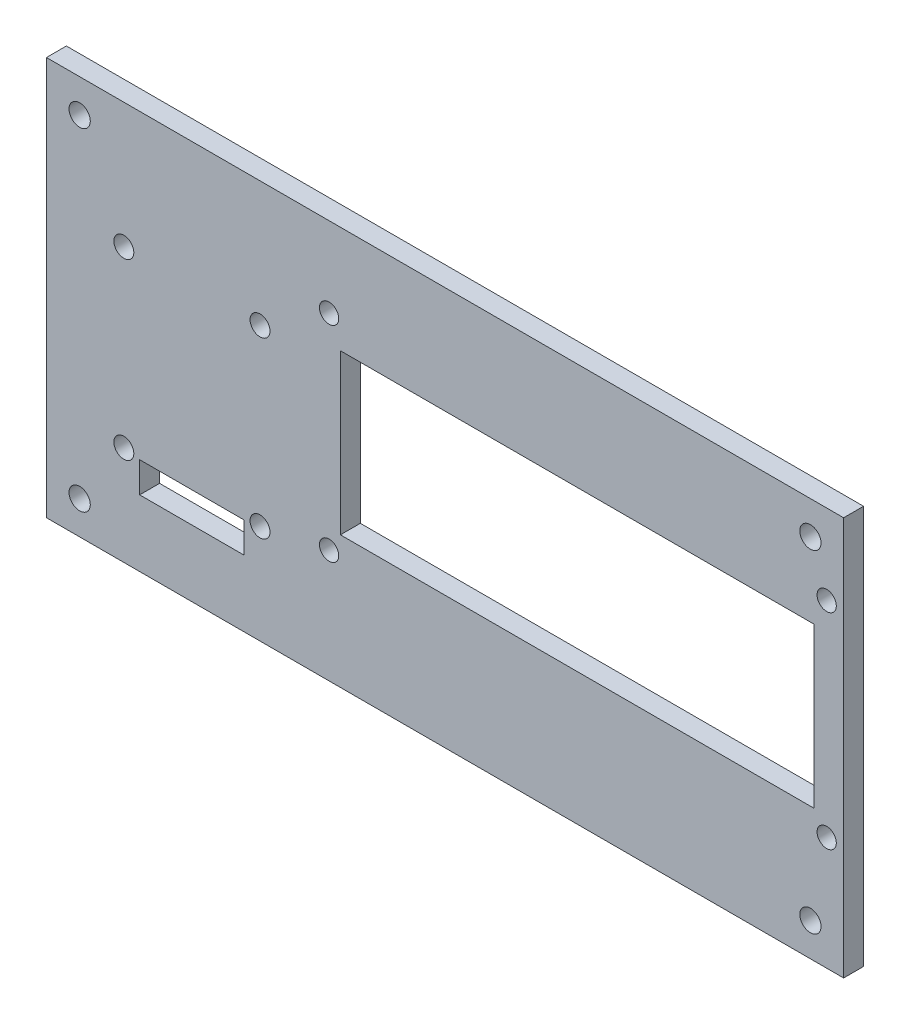
from build123d import *

# Parameters (mm, degrees)
SKETCH1_W           = 120
SKETCH1_H           = 60
BOSS_EXTRUDE1_DEPTH = 3
SKETCH3_R           = 1.6
CUT_EXTRUDE2_DEPTH  = 73.520148402
SKETCH5_R           = 1.45
CUT_EXTRUDE4_DEPTH  = 73.520148402
SKETCH7_W           = 71.3
SKETCH7_H           = 24
CUT_EXTRUDE5_DEPTH  = 73.520148402
SKETCH8_R           = 1.5
SKETCH8_W           = 15.689778119
SKETCH8_H           = 4.586192705
CUT_EXTRUDE6_DEPTH  = 73.520148402


with BuildPart() as part:
    # Sketch1 → Boss-Extrude1 (new body)
    with BuildSketch(Plane.XY):
        with Locations((3.092575742, -5.63002681)):
            Rectangle(SKETCH1_W, SKETCH1_H)
    extrude(amount=BOSS_EXTRUDE1_DEPTH)

    # Sketch3 → Cut-Extrude2 (cut, through all)
    with BuildSketch(Plane.XY.offset(3)):
        with Locations((58.092575742, 19.36997319)):
            Circle(SKETCH3_R)
        with Locations((58.092575742, -30.63002681)):
            Circle(SKETCH3_R)
        with Locations((-51.907424258, -30.63002681)):
            Circle(SKETCH3_R)
        with Locations((-51.907424258, 19.36997319)):
            Circle(SKETCH3_R)
    extrude(amount=-CUT_EXTRUDE2_DEPTH, mode=Mode.SUBTRACT)

    # Sketch5 → Cut-Extrude4 (cut, through all)
    with BuildSketch(Plane(origin=(0, 0, 0), x_dir=(-1, 0, 0), z_dir=(0, 0, -1))):
        with Locations((14.357424258, 12.31997319)):
            Circle(SKETCH5_R)
        with Locations((14.357424258, -18.58002681)):
            Circle(SKETCH5_R)
        with Locations((-60.542575742, -18.58002681)):
            Circle(SKETCH5_R)
        with Locations((-60.542575742, 12.31997319)):
            Circle(SKETCH5_R)
    extrude(amount=-CUT_EXTRUDE4_DEPTH, mode=Mode.SUBTRACT)

    # Sketch7 → Cut-Extrude5 (cut, through all)
    with BuildSketch(Plane.XY.offset(3)):
        with Locations((22.992575742, -3.73002681)):
            Rectangle(SKETCH7_W, SKETCH7_H)
    extrude(amount=-CUT_EXTRUDE5_DEPTH, mode=Mode.SUBTRACT)

    # Sketch8 → Cut-Extrude6 (cut, through all)
    with BuildSketch(Plane.XY.offset(3)):
        with Locations((-45.257424258, 5.51997319)):
            Circle(SKETCH8_R)
        with Locations((-24.757424258, 5.51997319)):
            Circle(SKETCH8_R)
        with Locations((-24.757424258, -20.68002681)):
            Circle(SKETCH8_R)
        with Locations((-45.257424258, -20.68002681)):
            Circle(SKETCH8_R)
        with Locations((-35.029761386, -23.336930458)):
            Rectangle(SKETCH8_W, SKETCH8_H)
    extrude(amount=-CUT_EXTRUDE6_DEPTH, mode=Mode.SUBTRACT)


solid = part.part
